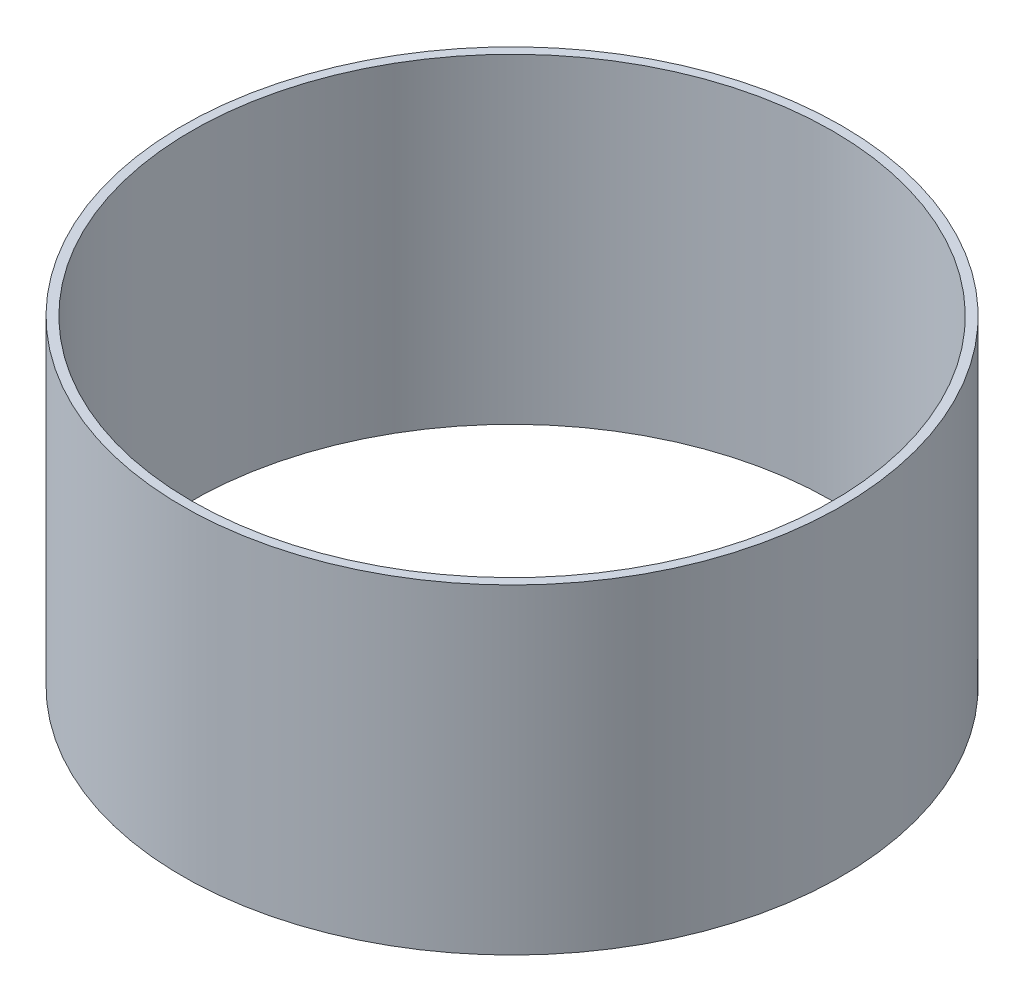
from build123d import *

# Parameters (mm, degrees)
SKETCH1_R           = 78.359
SKETCH1_R_2         = 76.2
BOSS_EXTRUDE1_DEPTH = 76.2


with BuildPart() as part:
    # Sketch1 → Boss-Extrude1 (new body)
    with BuildSketch(Plane(origin=(0, 0, 0), x_dir=(1, 0, 0), z_dir=(0, 1, 0))):
        with Locations(Location((0, 0, 0), (0, 0, 90))):
            Circle(SKETCH1_R)
        with Locations(Location((0, 0, 0), (0, 0, 90))):
            Circle(SKETCH1_R_2, mode=Mode.SUBTRACT)
    extrude(amount=BOSS_EXTRUDE1_DEPTH)


solid = part.part
